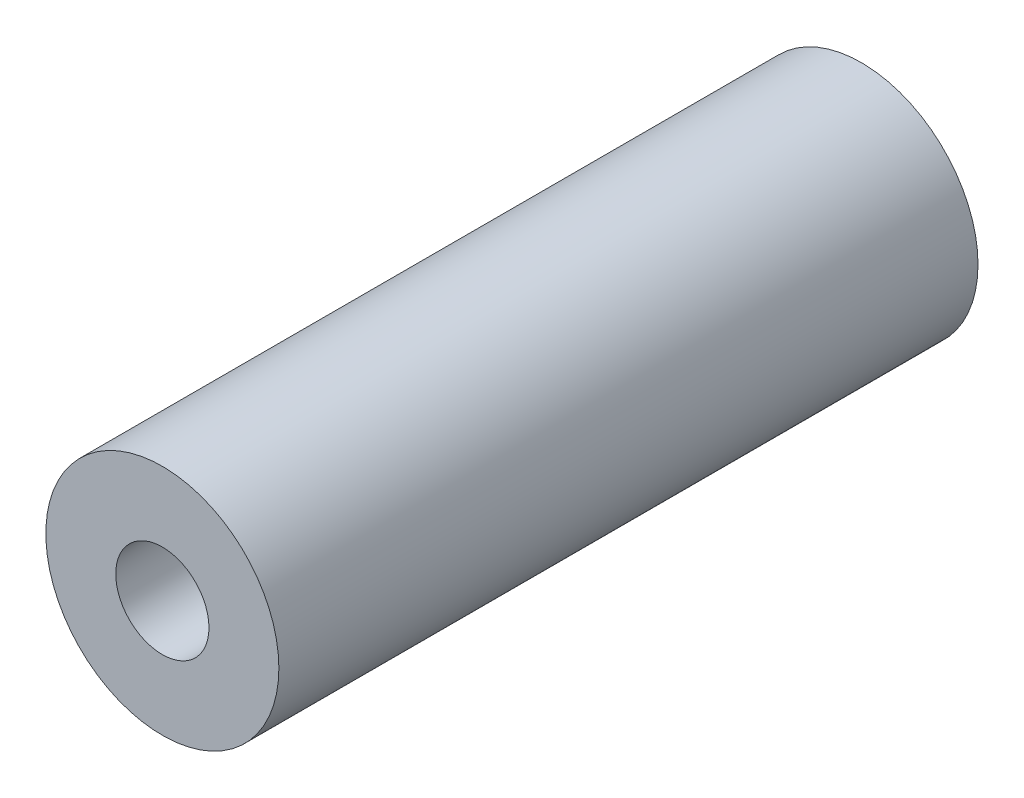
from build123d import *

# Parameters (mm, degrees)
STANDOFF_OD8_ID3P2_PROFILE_R   = 4
STANDOFF_OD8_ID3P2_PROFILE_R_2 = 1.6
STANDOFF_OD8_ID3P2_DEPTH       = 24


with BuildPart() as part:
    # Standoff_OD8_ID3p2_profile → Standoff_OD8_ID3p2 (new body)
    with BuildSketch(Plane.XY):
        Circle(STANDOFF_OD8_ID3P2_PROFILE_R)
        Circle(STANDOFF_OD8_ID3P2_PROFILE_R_2, mode=Mode.SUBTRACT)
    extrude(amount=STANDOFF_OD8_ID3P2_DEPTH)


solid = part.part
